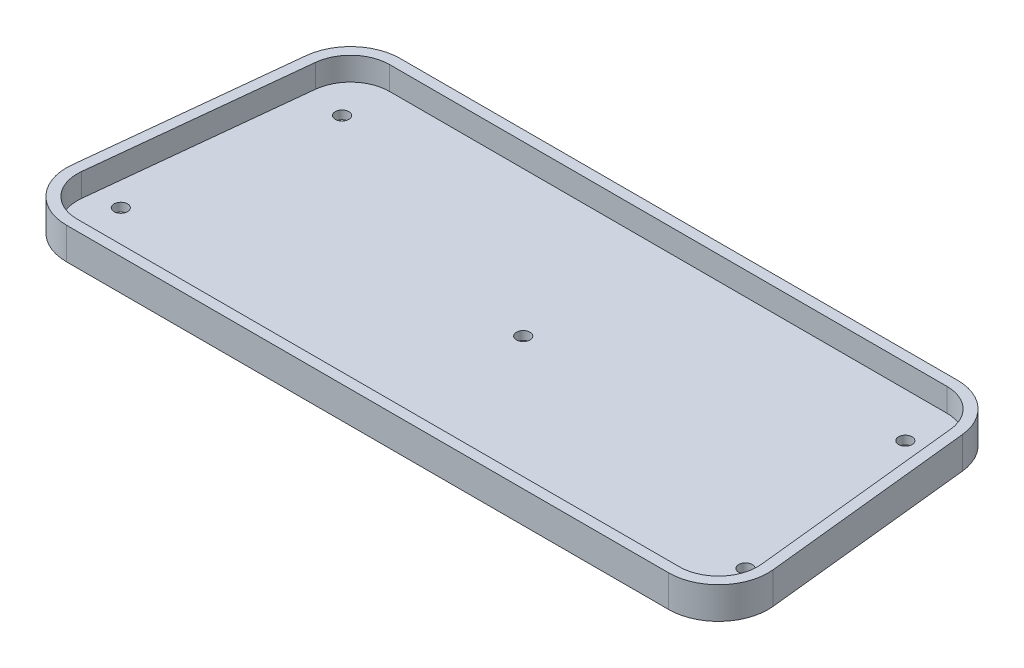
from build123d import *

# Parameters (mm, degrees)
SKETCH1_R           = 2.032
BOSS_EXTRUDE1_DEPTH = 2.54
BOSS_EXTRUDE2_DEPTH = 9.525


with BuildPart() as part:
    # Sketch1 → Boss-Extrude1 (new body)
    with BuildSketch(Plane(origin=(0, 0, 0), x_dir=(1, 0, 0), z_dir=(0, 1, 0))):
        with BuildLine():
            Line((-101.196460125, 62.269846472), (-107.93130861, -1.230153528))
            ThreePointArc((-107.93130861, -1.230153528), (-104.983139546, -10.325633674), (-96.249329296, -14.216651334))
            Line((-96.249329296, -14.216651334), (84.361550459, -14.216651334))
            ThreePointArc((84.361550459, -14.216651334), (93.095360709, -10.325633674), (96.043529773, -1.230153528))
            Line((96.043529773, -1.230153528), (89.308681288, 62.269846472))
            ThreePointArc((89.308681288, 62.269846472), (85.483184315, 69.764658916), (77.626701974, 72.778348666))
            Line((77.626701974, 72.778348666), (-89.514480811, 72.778348666))
            ThreePointArc((-89.514480811, 72.778348666), (-97.370963151, 69.764658916), (-101.196460125, 62.269846472))
        make_face()
        with Locations(Location((78.523810582, 59.410328666, 0), (0, 0, 270))):
            Circle(SKETCH1_R, mode=Mode.SUBTRACT)
        with Locations(Location((87.731310582, 2.260328666, 0), (0, 0, 270))):
            Circle(SKETCH1_R, mode=Mode.SUBTRACT)
        with Locations(Location((-5.943889418, 29.280848666, 0), (0, 0, 270))):
            Circle(SKETCH1_R, mode=Mode.SUBTRACT)
        with Locations(Location((-99.619089418, 2.260328666, 0), (0, 0, 270))):
            Circle(SKETCH1_R, mode=Mode.SUBTRACT)
        with Locations(Location((-90.411589418, 59.410328666, 0), (0, 0, 270))):
            Circle(SKETCH1_R, mode=Mode.SUBTRACT)
    extrude(amount=BOSS_EXTRUDE1_DEPTH)

    # Sketch4 → Boss-Extrude2 (add)
    with BuildSketch(Plane.XZ):
        with BuildLine():
            Line((99.200821479, 0.895289256), (92.465972995, -62.604710744))
            ThreePointArc((92.465972995, -62.604710744), (87.60655792, -72.125148173), (77.626701974, -75.953348666))
            Line((77.626701974, -75.953348666), (-89.514480811, -75.953348666))
            ThreePointArc((-89.514480811, -75.953348666), (-99.494336757, -72.125148173), (-104.353751831, -62.604710744))
            Line((-104.353751831, -62.604710744), (-111.088600316, 0.895289256))
            ThreePointArc((-111.088600316, 0.895289256), (-107.343628803, 12.44900728), (-96.249329296, 17.391651334))
            Line((-96.249329296, 17.391651334), (84.361550459, 17.391651334))
            ThreePointArc((84.361550459, 17.391651334), (95.455849966, 12.44900728), (99.200821479, 0.895289256))
        make_face()
        with BuildLine():
            ThreePointArc((-101.196460125, -62.269846472), (-97.370963151, -69.764658916), (-89.514480811, -72.778348666))
            Line((-89.514480811, -72.778348666), (77.626701974, -72.778348666))
            ThreePointArc((77.626701974, -72.778348666), (85.483184315, -69.764658916), (89.308681288, -62.269846472))
            Line((89.308681288, -62.269846472), (96.043529773, 1.230153528))
            ThreePointArc((96.043529773, 1.230153528), (93.095360709, 10.325633674), (84.361550459, 14.216651334))
            Line((84.361550459, 14.216651334), (-96.249329296, 14.216651334))
            ThreePointArc((-96.249329296, 14.216651334), (-104.983139546, 10.325633674), (-107.93130861, 1.230153528))
            Line((-107.93130861, 1.230153528), (-101.196460125, -62.269846472))
        make_face(mode=Mode.SUBTRACT)
    extrude(amount=-BOSS_EXTRUDE2_DEPTH)


solid = part.part
